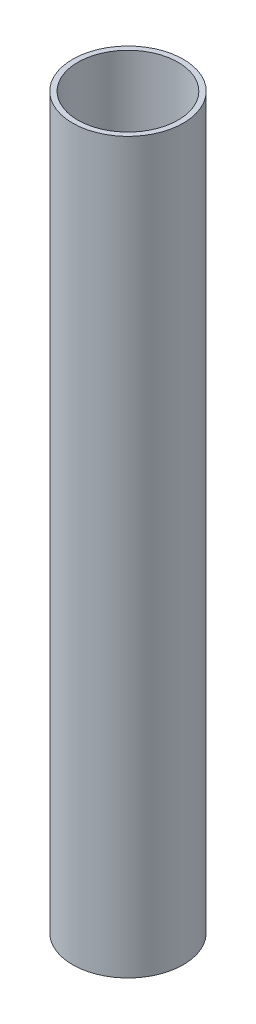
from build123d import *

# Parameters (mm, degrees)
SKETCH1_R           = 27
SKETCH1_R_2         = 24.46
BOSS_EXTRUDE1_DEPTH = 355.6


with BuildPart() as part:
    # Sketch1 → Boss-Extrude1 (new body)
    with BuildSketch(Plane(origin=(0, 0, 0), x_dir=(1, 0, 0), z_dir=(0, 1, 0))):
        with Locations(Location((0, 0, 0), (0, 0, 270))):
            Circle(SKETCH1_R)
        with Locations(Location((0, 0, 0), (0, 0, 270))):
            Circle(SKETCH1_R_2, mode=Mode.SUBTRACT)
    extrude(amount=BOSS_EXTRUDE1_DEPTH)


solid = part.part
